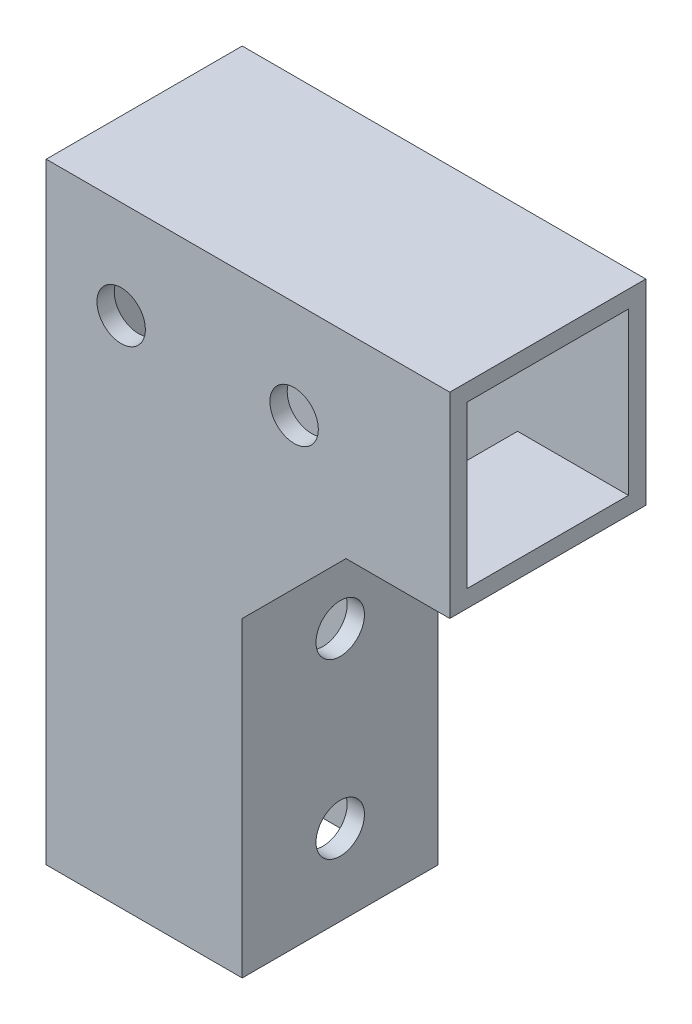
from build123d import *

# Parameters (mm, degrees)
SHAPE_DEPTH                  = 17
SKETCH2_W                    = 14
SKETCH2_H                    = 14
THRUST_LOAD_CELL_SLOT_DEPTH  = 51.5
CHAMFER_HOLLOWING_DEPTH      = 14
SKETCH3_R                    = 2.1
THRUST_LOAD_CELL_HOLES_DEPTH = 66.749524713
SKETCH4_W                    = 14
SKETCH4_H                    = 14
TORQUE_LOAD_CELL_SLOT_DEPTH  = 27
SKETCH7_R                    = 2.1
TORQUE_LOAD_CELL_HOLES_DEPTH = 66.749524713
SKETCH8_W                    = 5
SKETCH8_H                    = 16
BOSS_EXTRUDE2_DEPTH          = 2
CUT_EXTRUDE1_DEPTH           = 15


with BuildPart() as part:
    # Sketch1 → Shape (new body)
    with BuildSketch(Plane.XY):
        Polygon((0, 0), (17, 0), (17, 27), (26, 36), (35, 36), (35, 53), (0, 53), align=None)
    extrude(amount=SHAPE_DEPTH)

    # Sketch2 → Thrust Load Cell Slot (cut)
    with BuildSketch(Plane(origin=(0, 0, 0), x_dir=(1, 0, 0), z_dir=(0, 1, 0))):
        with Locations((8.5, -8.5)):
            Rectangle(SKETCH2_W, SKETCH2_H)
    extrude(amount=THRUST_LOAD_CELL_SLOT_DEPTH, mode=Mode.SUBTRACT)

    # Sketch6 → Chamfer Hollowing (cut)
    with BuildSketch(Plane.XY.offset(1.5)):
        Polygon((25.378679656, 37.5), (15.5, 27.621320344), (15.5, 37.5), align=None)
    extrude(amount=CHAMFER_HOLLOWING_DEPTH, mode=Mode.SUBTRACT)

    # Sketch3 → Thrust Load Cell Holes (cut, through all)
    with BuildSketch(Plane(origin=(0, 0, 0), x_dir=(0, 0, -1), z_dir=(1, 0, 0))):
        with Locations((-8.5, 22)):
            Circle(SKETCH3_R)
        with Locations((-8.5, 7)):
            Circle(SKETCH3_R)
    extrude(amount=THRUST_LOAD_CELL_HOLES_DEPTH, mode=Mode.SUBTRACT)

    # Sketch4 → Torque Load Cell Slot (cut)
    with BuildSketch(Plane(origin=(35, 0, 0), x_dir=(0, 0, -1), z_dir=(1, 0, 0))):
        with Locations((-8.5, 44.5)):
            Rectangle(SKETCH4_W, SKETCH4_H)
    extrude(amount=-TORQUE_LOAD_CELL_SLOT_DEPTH, mode=Mode.SUBTRACT)

    # Sketch7 → Torque Load Cell Holes (cut, through all)
    with BuildSketch(Plane.XY):
        with Locations((6.5, 44.5)):
            Circle(SKETCH7_R)
        with Locations((21.5, 44.5)):
            Circle(SKETCH7_R)
    extrude(amount=TORQUE_LOAD_CELL_HOLES_DEPTH, mode=Mode.SUBTRACT)

    # Sketch8 → Boss-Extrude2 (add)
    with BuildSketch(Plane(origin=(0, 0, 0), x_dir=(0, 0, -1), z_dir=(1, 0, 0))):
        with Locations((-8.5, 41)):
            Rectangle(SKETCH8_W, SKETCH8_H)
    extrude(amount=-BOSS_EXTRUDE2_DEPTH)

    # Sketch9 → Cut-Extrude1 (cut)
    with BuildSketch(Plane(origin=(0, 49, 0), x_dir=(1, 0, 0), z_dir=(0, 1, 0))):
        Polygon((-2, -7.95), (-1.1, -7.95), (-1.1, -6.9), (0, -6.9), (0, -10.1), (-1.1, -10.1), (-1.1, -9.05), (-2, -9.05), align=None)
    extrude(amount=-CUT_EXTRUDE1_DEPTH, mode=Mode.SUBTRACT)


solid = part.part
